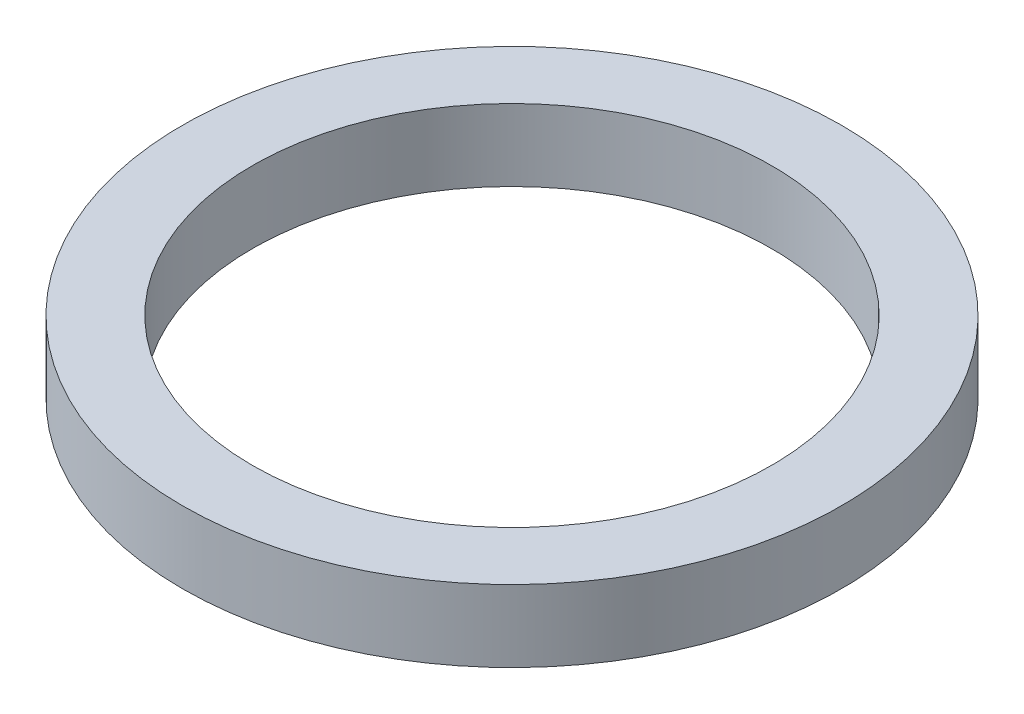
from build123d import *

# Parameters (mm, degrees)
SKETCH_1_R      = 82.5
SKETCH_1_R_2    = 65
EXTRUDE_1_DEPTH = 18


with BuildPart() as part:
    # 草图1 → 凸台-拉伸1 (new body)
    with BuildSketch(Plane(origin=(0, 0, 0), x_dir=(1, 0, 0), z_dir=(0, 1, 0))):
        with Locations(Location((0, 0, 0), (0, 0, 270))):
            Circle(SKETCH_1_R)
        with Locations(Location((0, 0, 0), (0, 0, 270))):
            Circle(SKETCH_1_R_2, mode=Mode.SUBTRACT)
    extrude(amount=EXTRUDE_1_DEPTH)


solid = part.part
